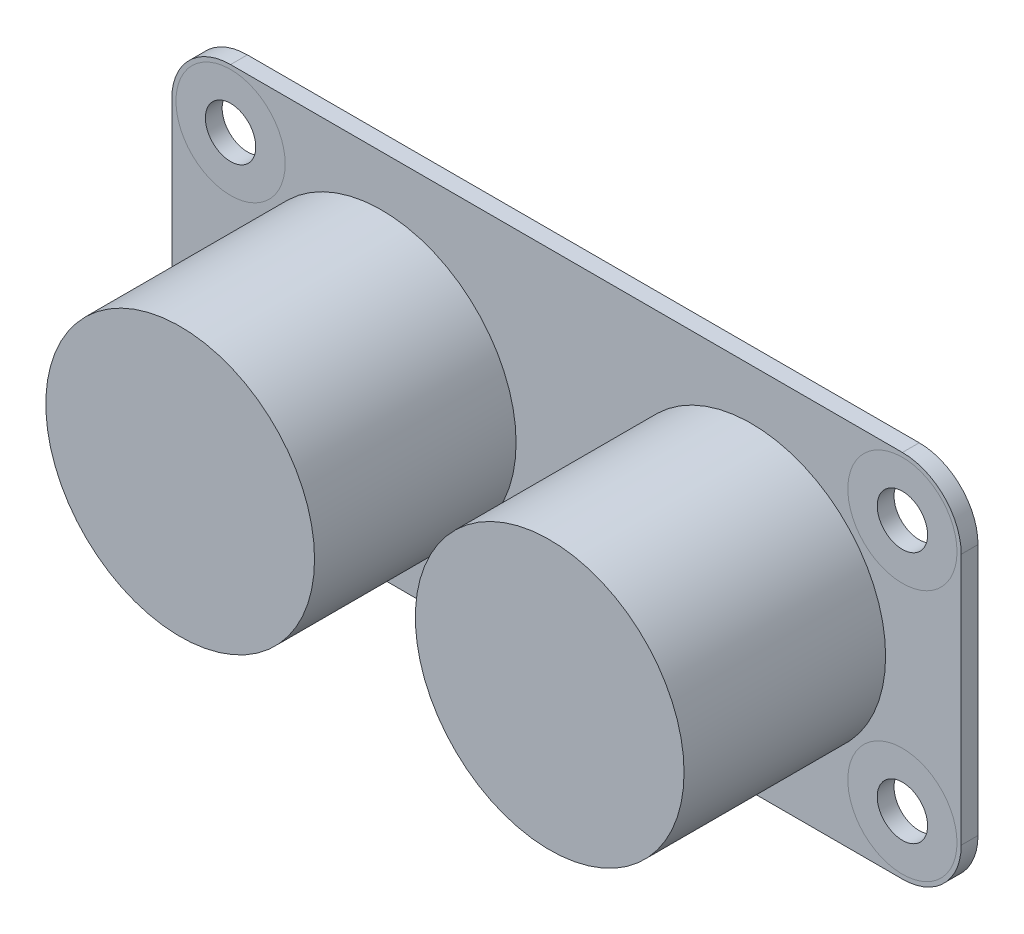
from build123d import *

# Parameters (mm, degrees)
SKETCH1_W           = 47
SKETCH1_H           = 22
SKETCH1_R           = 8
BOSS_EXTRUDE1_DEPTH = 1
BOSS_EXTRUDE2_START = 1
SKETCH1_3_R         = 8
BOSS_EXTRUDE2_DEPTH = 12
SKETCH2_3_R         = 1.5
CUT_EXTRUDE1_DEPTH  = 1
FILLET1_R           = 3.5
SKETCH3_W           = 10
SKETCH3_H           = 6
BOSS_EXTRUDE3_DEPTH = 6
SKETCH4_W           = 8
SKETCH4_H           = 5
BOSS_EXTRUDE4_DEPTH = 2.5
SKETCH5_R           = 0.75
BOSS_EXTRUDE5_DEPTH = 3


with BuildPart() as part:
    # Sketch1 → Boss-Extrude1 (new body)
    # profile 1 of 3: a face of its own
    with BuildSketch(Plane.XY):
        Rectangle(SKETCH1_W, SKETCH1_H)
        with Locations((-11, 0)):
            Circle(SKETCH1_R, mode=Mode.SUBTRACT)
        with Locations((11, 0)):
            Circle(SKETCH1_R, mode=Mode.SUBTRACT)
    # profile 2 of 3: a face of its own
    with BuildSketch(Plane.XY):
        with Locations((11, 0)):
            Circle(SKETCH1_R)
    # profile 3 of 3: a face of its own
    with BuildSketch(Plane.XY):
        with Locations((-11, 0)):
            Circle(SKETCH1_R)
    extrude(amount=BOSS_EXTRUDE1_DEPTH)

    # Sketch1<3> → Boss-Extrude2 (add)
    with BuildSketch(Plane.XY.offset(BOSS_EXTRUDE2_START)):
        with Locations((11, 0)):
            Circle(SKETCH1_3_R)
        with Locations((-11, 0)):
            Circle(SKETCH1_3_R)
    extrude(amount=BOSS_EXTRUDE2_DEPTH)

    # Sketch2<3> → Cut-Extrude1 (cut)
    with BuildSketch(Plane.XY):
        with Locations((20, 7.5)):
            Circle(SKETCH2_3_R)
        with Locations((-20, 7.5)):
            Circle(SKETCH2_3_R)
        with Locations((-20, -7.5)):
            Circle(SKETCH2_3_R)
        with Locations((20, -7.5)):
            Circle(SKETCH2_3_R)
    extrude(amount=CUT_EXTRUDE1_DEPTH, mode=Mode.SUBTRACT)

    # Fillet1
    fillet1_edges = [part.edges().sort_by_distance(p)[0] for p in [
        (-23.5, 11, 0.5),
        (23.5, 11, 0.5),
        (23.5, -11, 0.5),
        (-23.5, -11, 0.5),
    ]]
    fillet(fillet1_edges, radius=FILLET1_R)

    # Sketch3 → Boss-Extrude3 (add)
    with BuildSketch(Plane(origin=(0, 0, 0), x_dir=(-1, 0, 0), z_dir=(0, 0, -1))):
        with Locations((0, -8)):
            Rectangle(SKETCH3_W, SKETCH3_H)
    extrude(amount=BOSS_EXTRUDE3_DEPTH)

    # Sketch4 → Boss-Extrude4 (add)
    with BuildSketch(Plane(origin=(0, 0, -6), x_dir=(-1, 0, 0), z_dir=(0, 0, -1))):
        with Locations((0, -7.5)):
            Rectangle(SKETCH4_W, SKETCH4_H)
    extrude(amount=BOSS_EXTRUDE4_DEPTH)

    # Sketch5 → Boss-Extrude5 (add)
    with BuildSketch(Plane(origin=(0, 0, -8.5), x_dir=(-1, 0, 0), z_dir=(0, 0, -1))):
        with Locations((-2, -8)):
            Circle(SKETCH5_R)
        with Locations((0, -8)):
            Circle(SKETCH5_R)
        with Locations((2, -8)):
            Circle(SKETCH5_R)
    extrude(amount=BOSS_EXTRUDE5_DEPTH)


solid = part.part
